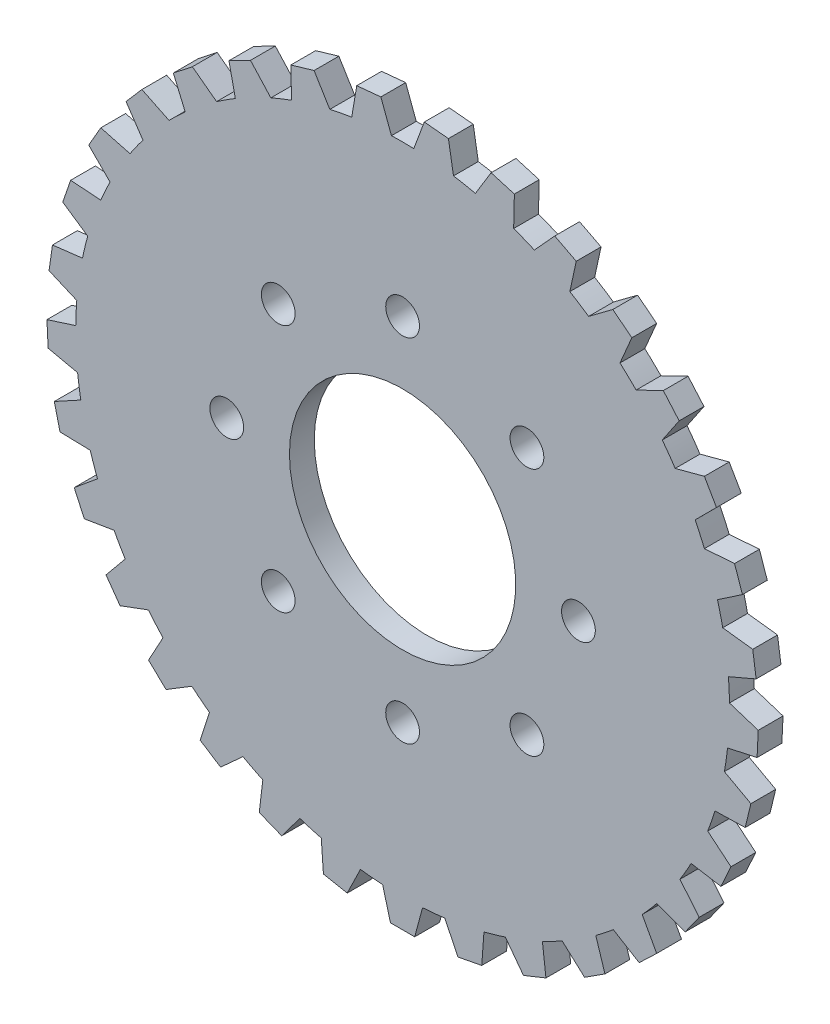
from build123d import *

# Parameters (mm, degrees)
BOSS_EXTRUDE1_DEPTH = 6.35
SKETCH2_R           = 28.956
SKETCH2_R_2         = 4.318
CUT_EXTRUDE1_DEPTH  = 129.84998677


with BuildPart() as part:
    # Sketch1 → Boss-Extrude1 (new body)
    with BuildSketch(Plane.XY):
        with BuildLine():
            Line((2.85403164, 83.616306594), (5.563187423, 90.860395533))
            Line((5.563187423, 90.860395533), (11.732789539, 90.271269961))
            Line((11.732789539, 90.271269961), (13.022034501, 82.645380043))
            ThreePointArc((13.022034501, 82.645380043), (15.833705359, 82.153064456), (18.626945642, 81.565121964))
            Line((18.626945642, 81.565121964), (22.658096297, 88.165589676))
            Line((22.658096297, 88.165589676), (28.604712917, 86.419505493))
            Line((28.604712917, 86.419505493), (28.427450387, 78.687434127))
            ThreePointArc((28.427450387, 78.687434127), (31.095139353, 77.671903116), (33.726633297, 76.565961311))
            Line((33.726633297, 76.565961311), (38.934082535, 82.284249695))
            Line((38.934082535, 82.284249695), (44.442787442, 79.444314933))
            Line((44.442787442, 79.444314933), (42.805424149, 71.885519323))
            ThreePointArc((42.805424149, 71.885519323), (45.232713992, 70.383476824), (47.60735255, 68.799507325))
            Line((47.60735255, 68.799507325), (53.802889589, 73.42894254))
            Line((53.802889589, 73.42894254), (58.674583834, 69.597799841))
            Line((58.674583834, 69.597799841), (55.636298354, 62.485474556))
            ThreePointArc((55.636298354, 62.485474556), (57.735460496, 60.551208298), (59.767418042, 58.546459889))
            Line((59.767418042, 58.546459889), (66.727120031, 61.919722085))
            Line((66.727120031, 61.919722085), (70.785727891, 57.235838927))
            Line((70.785727891, 57.235838927), (66.456331777, 50.827041933))
            ThreePointArc((66.456331777, 50.827041933), (68.151497028, 48.530461339), (69.767333324, 46.177390852))
            Line((69.767333324, 46.177390852), (77.239658499, 48.172561544))
            Line((77.239658499, 48.172561544), (80.338491312, 42.805225668))
            Line((80.338491312, 42.805225668), (74.87446022, 37.331587587))
            ThreePointArc((74.87446022, 37.331587587), (76.104360891, 34.755697063), (77.245675402, 32.139350595))
            Line((77.245675402, 32.139350595), (84.960554463, 32.684319115))
            Line((84.960554463, 32.684319115), (86.987612337, 26.827520026))
            Line((86.987612337, 26.827520026), (80.586430587, 22.486872398))
            ThreePointArc((80.586430587, 22.486872398), (81.306614864, 19.724771339), (81.93215751, 16.939710469))
            Line((81.93215751, 16.939710469), (89.610754626, 16.014780236))
            Line((89.610754626, 16.014780236), (90.492774408, 9.880197911))
            Line((90.492774408, 9.880197911), (83.385797386, 6.829423052))
            ThreePointArc((83.385797386, 6.829423052), (83.570235933, 3.980940987), (83.657397973, 1.127825071))
            Line((83.657397973, 1.127825071), (91.022188639, -1.233574527))
            Line((91.022188639, -1.233574527), (90.727291835, -7.424220299))
            Line((90.727291835, -7.424220299), (83.171384209, -9.074859436))
            ThreePointArc((83.171384209, -9.074859436), (82.813410935, -11.906770944), (82.359042106, -14.724822863))
            Line((82.359042106, -14.724822863), (89.143843598, -18.437344692))
            Line((89.143843598, -18.437344692), (87.682688548, -24.460307843))
            Line((87.682688548, -24.460307843), (79.950940505, -24.651152861))
            ThreePointArc((79.950940505, -24.651152861), (79.063493498, -27.364141151), (78.084015873, -30.045277335))
            Line((78.084015873, -30.045277335), (84.043607787, -34.974741183))
            Line((84.043607787, -34.974741183), (81.469004441, -40.612336132))
            Line((81.469004441, -40.612336132), (73.840861501, -39.336489393))
            ThreePointArc((73.840861501, -39.336489393), (72.456015408, -41.8325), (70.986829861, -44.279817201))
            Line((70.986829861, -44.279817201), (75.905817018, -50.248059401))
            Line((75.905817018, -50.248059401), (72.310818249, -55.296528778))
            Line((72.310818249, -55.296528778), (65.061981372, -52.600102708))
            ThreePointArc((65.061981372, -52.600102708), (63.229788138, -54.788923305), (61.323994863, -56.913969103))
            Line((61.323994863, -56.913969103), (65.024592251, -63.705281833))
            Line((65.024592251, -63.705281833), (60.539130681, -67.982160801))
            Line((60.539130681, -67.982160801), (53.931591719, -63.962611264))
            ThreePointArc((53.931591719, -63.962611264), (51.718271582, -65.765132172), (49.444750912, -67.491101874))
            Line((49.444750912, -67.491101874), (51.7932093, -74.860029396))
            Line((51.7932093, -74.860029396), (46.579401197, -78.210740406))
            Line((46.579401197, -78.210740406), (40.851973824, -73.013344395))
            ThreePointArc((40.851973824, -73.013344395), (38.33752194, -74.364417812), (35.778444837, -75.628930378))
            Line((35.778444837, -75.628930378), (36.689884819, -83.309140451))
            Line((36.689884819, -83.309140451), (30.936170793, -85.612580077))
            Line((30.936170793, -85.612580077), (26.295859156, -79.425185025))
            ThreePointArc((26.295859156, -79.425185025), (23.571154368, -80.275979637), (20.819012545, -81.033332288))
            Line((20.819012545, -81.033332288), (20.260492306, -88.747242111))
            Line((20.260492306, -88.747242111), (14.174826572, -89.920158042))
            Line((14.174826572, -89.920158042), (10.789343625, -82.966392528))
            ThreePointArc((10.789343625, -82.966392528), (7.952863863, -83.286158402), (5.107126896, -83.508978439))
            Line((5.107126896, -83.508978439), (3.098832813, -90.977787212))
            Line((3.098832813, -90.977787212), (-3.098832812, -90.977787212))
            Line((-3.098832812, -90.977787212), (-5.107126896, -83.508978439))
            ThreePointArc((-5.107126896, -83.508978439), (-7.952863863, -83.286158402), (-10.789343625, -82.966392528))
            Line((-10.789343625, -82.966392528), (-14.174826572, -89.920158042))
            Line((-14.174826572, -89.920158042), (-20.260492306, -88.747242111))
            Line((-20.260492306, -88.747242111), (-20.819012545, -81.033332288))
            ThreePointArc((-20.819012545, -81.033332288), (-23.571154368, -80.275979637), (-26.295859156, -79.425185025))
            Line((-26.295859156, -79.425185025), (-30.936170793, -85.612580077))
            Line((-30.936170793, -85.612580077), (-36.689884818, -83.309140451))
            Line((-36.689884818, -83.309140451), (-35.778444837, -75.628930378))
            ThreePointArc((-35.778444837, -75.628930378), (-38.33752194, -74.364417812), (-40.851973824, -73.013344395))
            Line((-40.851973824, -73.013344395), (-46.579401197, -78.210740406))
            Line((-46.579401197, -78.210740406), (-51.7932093, -74.860029396))
            Line((-51.7932093, -74.860029396), (-49.444750912, -67.491101875))
            ThreePointArc((-49.444750912, -67.491101875), (-51.718271582, -65.765132172), (-53.931591719, -63.962611264))
            Line((-53.931591719, -63.962611264), (-60.539130681, -67.982160801))
            Line((-60.539130681, -67.982160801), (-65.024592251, -63.705281833))
            Line((-65.024592251, -63.705281833), (-61.323994863, -56.913969103))
            ThreePointArc((-61.323994863, -56.913969103), (-63.229788138, -54.788923306), (-65.061981372, -52.600102708))
            Line((-65.061981372, -52.600102708), (-72.310818249, -55.296528778))
            Line((-72.310818249, -55.296528778), (-75.905817018, -50.248059401))
            Line((-75.905817018, -50.248059401), (-70.986829861, -44.279817201))
            ThreePointArc((-70.986829861, -44.279817201), (-72.456015408, -41.8325), (-73.840861501, -39.336489393))
            Line((-73.840861501, -39.336489393), (-81.469004441, -40.612336132))
            Line((-81.469004441, -40.612336132), (-84.043607787, -34.974741183))
            Line((-84.043607787, -34.974741183), (-78.084015873, -30.045277335))
            ThreePointArc((-78.084015873, -30.045277335), (-79.063493498, -27.364141151), (-79.950940505, -24.651152861))
            Line((-79.950940505, -24.651152861), (-87.682688547, -24.460307844))
            Line((-87.682688547, -24.460307844), (-89.143843598, -18.437344693))
            Line((-89.143843598, -18.437344693), (-82.359042106, -14.724822863))
            ThreePointArc((-82.359042106, -14.724822863), (-82.813410935, -11.906770944), (-83.171384209, -9.074859436))
            Line((-83.171384209, -9.074859436), (-90.727291835, -7.424220299))
            Line((-90.727291835, -7.424220299), (-91.022188639, -1.233574527))
            Line((-91.022188639, -1.233574527), (-83.657397973, 1.127825071))
            ThreePointArc((-83.657397973, 1.127825071), (-83.570235933, 3.980940987), (-83.385797386, 6.829423052))
            Line((-83.385797386, 6.829423052), (-90.492774407, 9.880197911))
            Line((-90.492774407, 9.880197911), (-89.610754626, 16.014780236))
            Line((-89.610754626, 16.014780236), (-81.93215751, 16.939710469))
            ThreePointArc((-81.93215751, 16.939710469), (-81.306614864, 19.724771339), (-80.586430587, 22.486872398))
            Line((-80.586430587, 22.486872398), (-86.987612336, 26.827520026))
            Line((-86.987612336, 26.827520026), (-84.960554463, 32.684319115))
            Line((-84.960554463, 32.684319115), (-77.245675402, 32.139350595))
            ThreePointArc((-77.245675402, 32.139350595), (-76.104360891, 34.755697063), (-74.87446022, 37.331587587))
            Line((-74.87446022, 37.331587587), (-80.338491312, 42.805225668))
            Line((-80.338491312, 42.805225668), (-77.239658499, 48.172561544))
            Line((-77.239658499, 48.172561544), (-69.767333324, 46.177390852))
            ThreePointArc((-69.767333324, 46.177390852), (-68.151497028, 48.530461339), (-66.456331777, 50.827041933))
            Line((-66.456331777, 50.827041933), (-70.785727891, 57.235838927))
            Line((-70.785727891, 57.235838927), (-66.727120031, 61.919722085))
            Line((-66.727120031, 61.919722085), (-59.767418042, 58.546459889))
            ThreePointArc((-59.767418042, 58.546459889), (-57.735460496, 60.551208298), (-55.636298354, 62.485474556))
            Line((-55.636298354, 62.485474556), (-58.674583834, 69.597799841))
            Line((-58.674583834, 69.597799841), (-53.802889589, 73.42894254))
            Line((-53.802889589, 73.42894254), (-47.60735255, 68.799507325))
            ThreePointArc((-47.60735255, 68.799507325), (-45.232713992, 70.383476824), (-42.805424149, 71.885519323))
            Line((-42.805424149, 71.885519323), (-44.442787442, 79.444314933))
            Line((-44.442787442, 79.444314933), (-38.934082535, 82.284249695))
            Line((-38.934082535, 82.284249695), (-33.726633297, 76.565961311))
            ThreePointArc((-33.726633297, 76.565961311), (-31.095139353, 77.671903116), (-28.427450387, 78.687434127))
            Line((-28.427450387, 78.687434127), (-28.604712917, 86.419505493))
            Line((-28.604712917, 86.419505493), (-22.658096297, 88.165589676))
            Line((-22.658096297, 88.165589676), (-18.626945642, 81.565121964))
            ThreePointArc((-18.626945642, 81.565121964), (-15.833705359, 82.153064456), (-13.022034501, 82.645380043))
            Line((-13.022034501, 82.645380043), (-11.732789539, 90.271269961))
            Line((-11.732789539, 90.271269961), (-5.563187423, 90.860395533))
            Line((-5.563187423, 90.860395533), (-2.85403164, 83.616306594))
            ThreePointArc((-2.85403164, 83.616306594), (0, 83.665), (2.85403164, 83.616306594))
        make_face()
    extrude(amount=BOSS_EXTRUDE1_DEPTH)

    # Sketch2 → Cut-Extrude1 (cut, through all)
    with BuildSketch(Plane(origin=(0, 0, 0), x_dir=(-1, 0, 0), z_dir=(0, 0, -1))):
        Circle(SKETCH2_R)
        with Locations((0, 45.0088)):
            Circle(SKETCH2_R_2)
        with Locations((31.826027693, 31.826027693)):
            Circle(SKETCH2_R_2)
        with Locations((45.0088, 0)):
            Circle(SKETCH2_R_2)
        with Locations((31.826027693, -31.826027693)):
            Circle(SKETCH2_R_2)
        with Locations((0, -45.0088)):
            Circle(SKETCH2_R_2)
        with Locations((-31.826027693, -31.826027693)):
            Circle(SKETCH2_R_2)
        with Locations((-45.0088, 0)):
            Circle(SKETCH2_R_2)
        with Locations((-31.826027693, 31.826027693)):
            Circle(SKETCH2_R_2)
    extrude(amount=-CUT_EXTRUDE1_DEPTH, mode=Mode.SUBTRACT)


solid = part.part
